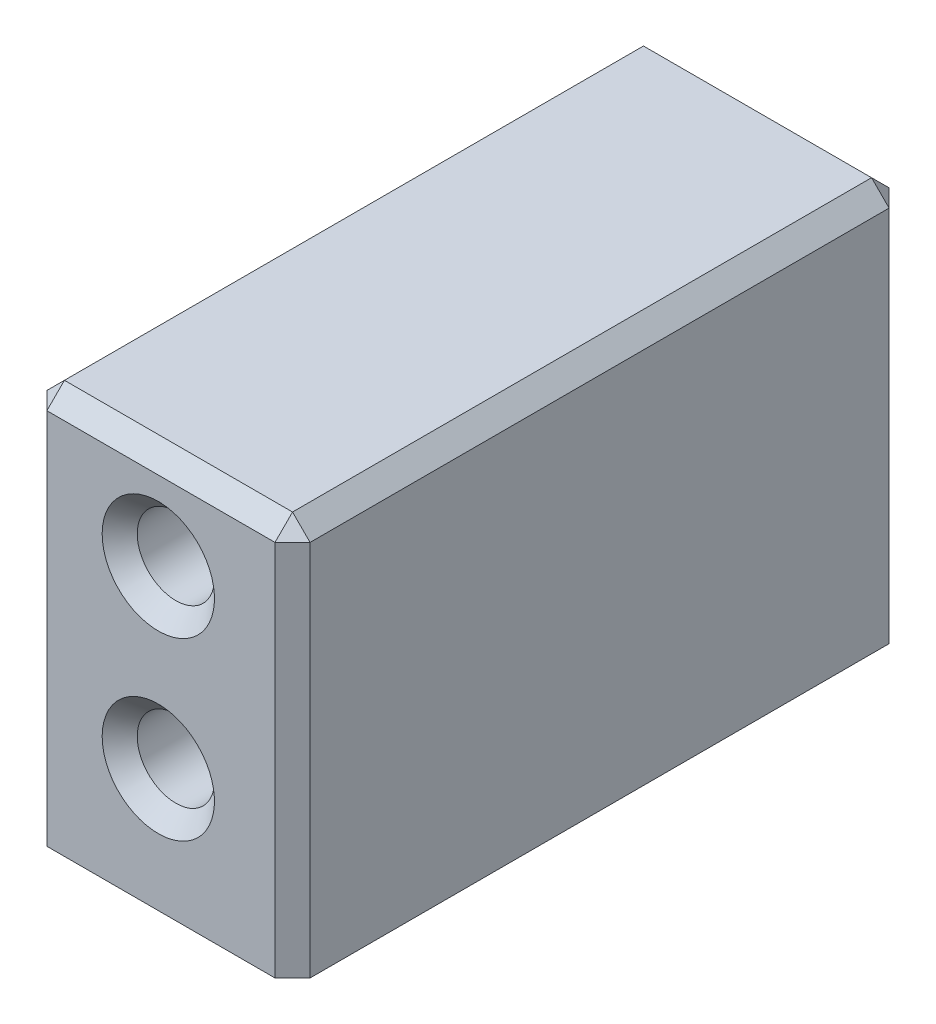
from build123d import *

# Parameters (mm, degrees)
SKETCH1_W           = 19.05
SKETCH1_H           = 44.45
BOSS_EXTRUDE1_DEPTH = 28.575
SKETCH3_R           = 2.794
CUT_EXTRUDE2_DEPTH  = 68.236705218
CHAMFER2_SIZE       = 1.27


with BuildPart() as part:
    # Sketch1 → Boss-Extrude1 (new body)
    with BuildSketch(Plane(origin=(0, 0, 0), x_dir=(1, 0, 0), z_dir=(0, 1, 0))):
        with Locations((-32.049528302, -0.918054245)):
            Rectangle(SKETCH1_W, SKETCH1_H)
    extrude(amount=BOSS_EXTRUDE1_DEPTH)

    # Sketch3 → Cut-Extrude2 (cut, through all)
    with BuildSketch(Plane.XY.offset(23.143054245)):
        with Locations((-32.240028302, 34.29)):
            Circle(SKETCH3_R)
        with Locations((-32.240028302, 21.59)):
            Circle(SKETCH3_R)
        with Locations((-32.240028302, 8.89)):
            Circle(SKETCH3_R)
    extrude(amount=-CUT_EXTRUDE2_DEPTH, mode=Mode.SUBTRACT)

    # Chamfer2
    chamfer2_edges = [part.edges().sort_by_distance(p)[0] for p in [
        (-32.049528302, 28.575, 23.143054245),
        (-22.524528302, 28.575, 0.918054245),
        (-35.034028302, 21.59, -21.306945755),
        (-35.034028302, 21.59, 23.143054245),
        (-35.034028302, 8.89, -21.306945755),
        (-35.034028302, 8.89, 23.143054245),
        (-32.049528302, 28.575, -21.306945755),
        (-22.524528302, 14.2875, -21.306945755),
        (-22.524528302, 14.2875, 23.143054245),
        (-41.574528302, 14.2875, 23.143054245),
        (-41.574528302, 14.2875, -21.306945755),
        (-41.574528302, 28.575, 0.918054245),
    ]]
    chamfer(chamfer2_edges, length=CHAMFER2_SIZE)


solid = part.part
